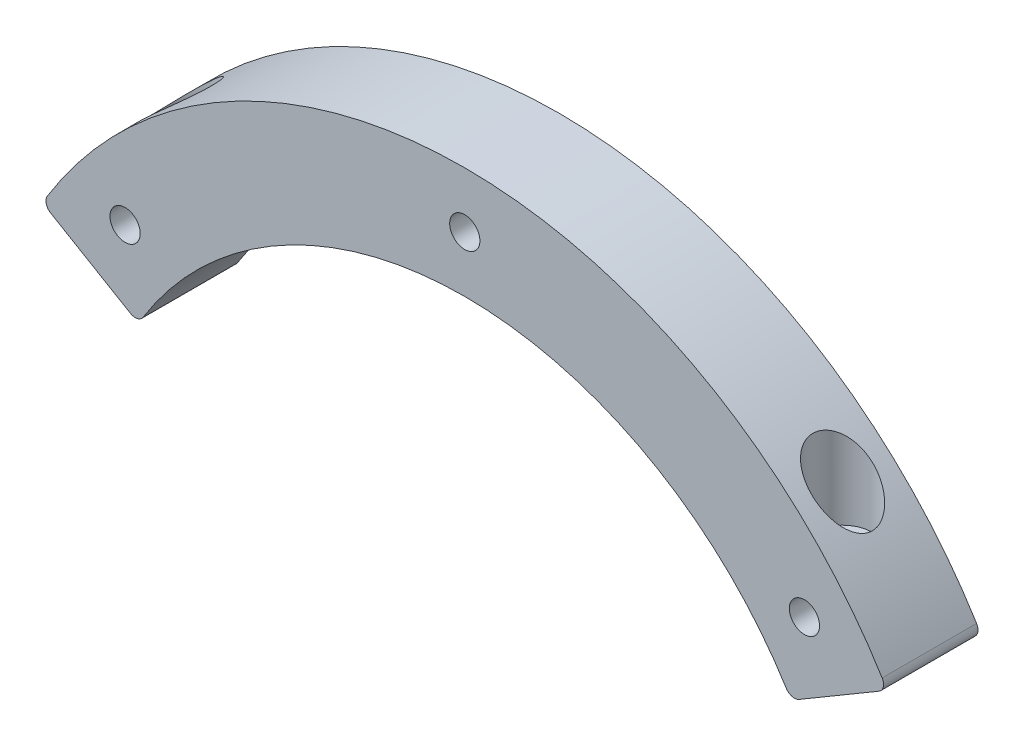
from build123d import *

# Parameters (mm, degrees)
AUFSATZ_LINEAR_AUSTRAGEN1_DEPTH = 10
VERRUNDUNG1_R                   = 1
SKIZZE2_R                       = 1.6
SCHNITT_LINEAR_AUSTRAGEN1_DEPTH = 10
SKIZZE3_R                       = 3.15
SCHNITT_LINEAR_AUSTRAGEN2_DEPTH = 20


with BuildPart() as part:
    # Skizze1 → Aufsatz-Linear austragen1 (new body)
    with BuildSketch(Plane.XY):
        with BuildLine():
            Line((-34.551329334, 20.352288355), (-44.718553427, 26.341241038))
            ThreePointArc((-44.718553427, 26.341241038), (0, 51.9), (44.718553427, 26.341241038))
            Line((44.718553427, 26.341241038), (34.551329334, 20.352288355))
            ThreePointArc((34.551329334, 20.352288355), (0, 40.1), (-34.551329334, 20.352288355))
        make_face()
    extrude(amount=AUFSATZ_LINEAR_AUSTRAGEN1_DEPTH)

    # Verrundung1
    verrundung1_edges = [part.edges().sort_by_distance(p)[0] for p in [
        (-34.551329334, 20.352288355, 5),
        (-44.718553427, 26.341241038, 5),
        (44.718553427, 26.341241038, 5),
        (34.551329334, 20.352288355, 5),
    ]]
    fillet(verrundung1_edges, radius=VERRUNDUNG1_R)

    # Skizze2 → Schnitt-Linear austragen1 (cut)
    with BuildSketch(Plane.XY.offset(10)):
        with Locations((0, 46)):
            Circle(SKIZZE2_R)
        with Locations((35.964248194, 28.680530886)):
            Circle(SKIZZE2_R)
        with Locations((-35.964248194, 28.680530886)):
            Circle(SKIZZE2_R)
    extrude(amount=-SCHNITT_LINEAR_AUSTRAGEN1_DEPTH, mode=Mode.SUBTRACT)

    # Skizze3 → Schnitt-Linear austragen2 (cut)
    with BuildSketch(Plane(origin=(0, 51.9, 0), x_dir=(1, 0, 0), z_dir=(0, 1, 0))):
        with Locations(Location((-35, -5, 0), (0, 0, 270))):
            Circle(SKIZZE3_R)
        with Locations(Location((35, -5, 0), (0, 0, 270))):
            Circle(SKIZZE3_R)
    extrude(amount=-SCHNITT_LINEAR_AUSTRAGEN2_DEPTH, mode=Mode.SUBTRACT)


solid = part.part
